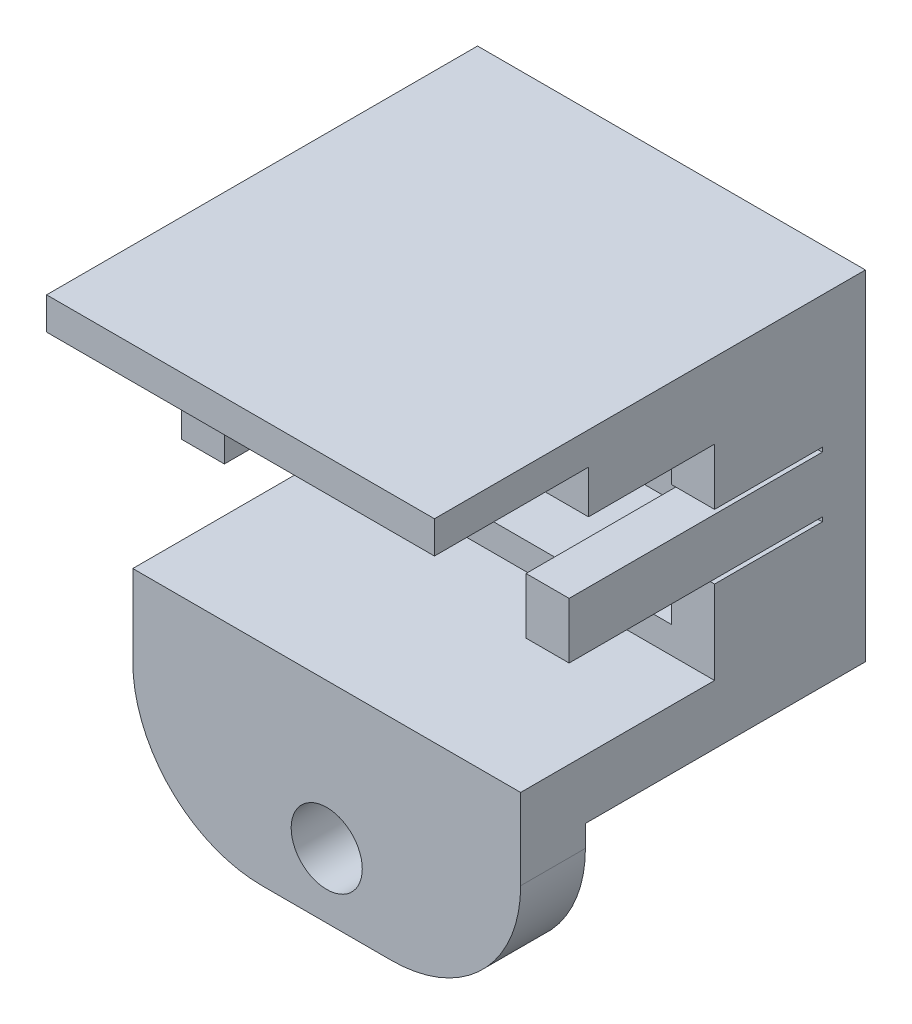
from build123d import *
from build123d.topology import SkipClean

# Parameters (mm, degrees)
ESBO_O1_R                 = 1.65
RESSALTO_EXTRUS_O1_DEPTH  = 3
RESSALTO_EXTRUS_O2_START  = 15
ESBO_O2_R                 = 1.65
RESSALTO_EXTRUS_O2_DEPTH  = 15
CORTE_EXTRUS_O1_DEPTH     = 15
RESSALTO_EXTRUS_O3_DEPTH  = 2
ESBO_O6_W                 = 23.468316857
ESBO_O6_H                 = 21.298976644
CORTE_EXTRUS_O2_DEPTH     = 21
ESBO_O7_W                 = 18
ESBO_O7_H                 = 18
RESSALTO_EXTRUS_O4_DEPTH  = 2
CORTE_EXTRUS_O3_DEPTH     = 5
ESBO_O9_W                 = 18
ESBO_O9_H                 = 2
CORTE_EXTRUS_O4_DEPTH     = 8
ESBO_O10_W                = 18
ESBO_O10_H                = 12.25
RESSALTO_EXTRUS_O5_DEPTH  = 2
RESSALTO_EXTRUS_O6_DEPTH  = 5.85
ESBO_O12_W                = 2
ESBO_O12_H                = 2.6
RESSALTO_EXTRUS_O7_DEPTH  = 9.75
ESBO_O13_W                = 18
ESBO_O13_H                = 7.85
RESSALTO_EXTRUS_O8_DEPTH  = 1.5
ESBO_O14_W                = 18
ESBO_O14_H                = 1.5
RESSALTO_EXTRUS_O9_DEPTH  = 5.15
ESBO_O15_R                = 3.125
CORTE_EXTRUS_O5_DEPTH     = 5.15
ESBO_O16_W                = 2
ESBO_O16_H                = 2.625
RESSALTO_EXTRUS_O10_DEPTH = 5
ESBO_O18_W                = 2
ESBO_O18_H                = 2.6
RESSALTO_EXTRUS_O11_DEPTH = 5
ESBO_O19_W                = 18
ESBO_O19_H                = 2
RESSALTO_EXTRUS_O12_DEPTH = 5
ESBO_O20_W                = 18
ESBO_O20_H                = 1.5
RESSALTO_EXTRUS_O13_DEPTH = 5
ESBO_O21_W                = 18
ESBO_O21_H                = 7
RESSALTO_EXTRUS_O14_DEPTH = 3
ESBO_O22_W                = 18
ESBO_O22_H                = 2.75
RESSALTO_EXTRUS_O15_DEPTH = 9
ESBO_O23_W                = 18
ESBO_O23_H                = 3.006158343
RESSALTO_EXTRUS_O16_DEPTH = 6
ESBO_O24_W                = 27.560641217
ESBO_O24_H                = 36.557163592
CORTE_EXTRUS_O6_DEPTH     = 26
ESBO_O25_W                = 18
ESBO_O25_H                = 1.5
RESSALTO_EXTRUS_O17_DEPTH = 2
ESBO_O26_R                = 1.65
CORTE_EXTRUS_O7_DEPTH     = 10
FILETE1_R                 = 6
ESBO_O27_W                = 18
ESBO_O27_H                = 12.993841657
CORTE_EXTRUS_O8_DEPTH     = 1
ESBO_O28_W                = 18
ESBO_O28_H                = 9
RESSALTO_EXTRUS_O18_DEPTH = 1
ESBO_O29_W                = 2
ESBO_O29_H                = 2.6
CORTE_EXTRUS_O9_DEPTH     = 3


with BuildPart() as part:
    # Esboço1 → Ressalto-extrusão1 (new body)
    # profile 1 of 3: a face of its own
    with BuildSketch(Plane.XY):
        Polygon((-7, 15.25), (-9, 15.25), (-9, 13.25), (-9, 5), (-6.541451884, 0), (-2.020725942, -6), (2.020725942, -6), (6.541451884, 0), (9, 5), (9, 15.25), (7, 15.25), align=None)
        Polygon((2.020725942, -3.5), (4.041451884, 0), (2.020725942, 3.5), (-2.020725942, 3.5), (-4.041451884, 0), (-2.020725942, -3.5), align=None, mode=Mode.SUBTRACT)
        Polygon((-7, 13.25), (-7, 5), (0, 5), (7, 5), (7, 13.25), align=None, mode=Mode.SUBTRACT)
    # profile 2 of 3: a face of its own
    with BuildSketch(Plane.XY):
        Polygon((7, 13.25), (-7, 13.25), (-7, 5), (0, 5), (7, 5), align=None)
    # profile 3 of 3: a face of its own
    with BuildSketch(Plane.XY):
        Polygon((-2.020725942, -3.5), (2.020725942, -3.5), (4.041451884, 0), (2.020725942, 3.5), (-2.020725942, 3.5), (-4.041451884, 0), align=None)
        Circle(ESBO_O1_R, mode=Mode.SUBTRACT)
    extrude(amount=RESSALTO_EXTRUS_O1_DEPTH)

    # Esboço2 → Ressalto-extrusão2 (add)
    # profile 1 of 2: a face of its own
    with SkipClean():  # the faces are left unmerged after this step: merging them gives an invalid solid
        with BuildSketch(Plane(origin=(0, 0, 0), x_dir=(-1, 0, 0), z_dir=(0, 0, -1)).offset(RESSALTO_EXTRUS_O2_START)):
            Polygon((9, 5), (9, 15.25), (-9, 15.25), (-9, 5), (-6.541451884, 0), (-2.020725942, -6), (2.020725942, -6), (6.541451884, 0), align=None)
            Polygon((7, 5), (7, 13.25), (-7, 13.25), (-7, 5), (0, 5), align=None, mode=Mode.SUBTRACT)
            Polygon((-4.041451884, 0), (-2.020725942, -3.5), (2.020725942, -3.5), (4.041451884, 0), (2.020725942, 3.5), (-2.020725942, 3.5), align=None, mode=Mode.SUBTRACT)
        # profile 2 of 2: a face of its own
        with BuildSketch(Plane(origin=(0, 0, 0), x_dir=(-1, 0, 0), z_dir=(0, 0, -1)).offset(RESSALTO_EXTRUS_O2_START)):
            Polygon((-2.020725942, 3.5), (-4.041451884, 0), (-2.020725942, -3.5), (2.020725942, -3.5), (4.041451884, 0), (2.020725942, 3.5), align=None)
            Circle(ESBO_O2_R, mode=Mode.SUBTRACT)
        extrude(amount=-RESSALTO_EXTRUS_O2_DEPTH)

    # Esboço3 → Corte-extrusão1 (cut)
    with SkipClean():  # the faces are left unmerged after this step: merging them gives an invalid solid
        with BuildSketch(Plane(origin=(0, 0, -15), x_dir=(-1, 0, 0), z_dir=(0, 0, -1))):
            Polygon((-9, 10.625), (-9, 9.125), (-9, 7.625), (-7, 7.625), (-7, 10.625), align=None)
            Polygon((9, 7.625), (9, 9.125), (9, 10.625), (7, 10.625), (7, 7.625), align=None)
        extrude(amount=-CORTE_EXTRUS_O1_DEPTH, mode=Mode.SUBTRACT)

    # Esboço5 → Ressalto-extrusão3 (add)
    with SkipClean():  # the faces are left unmerged after this step: merging them gives an invalid solid
        with BuildSketch(Plane(origin=(0, 0, 0), x_dir=(-1, 0, 0), z_dir=(0, 0, -1))):
            Polygon((-1.583333333, 13.25), (-2.333333333, 13.25), (-3.083333333, 13.25), (-3.083333333, 5), (-1.583333333, 5), align=None)
        extrude(amount=RESSALTO_EXTRUS_O3_DEPTH)

    # Esboço6 → Corte-extrusão2 (cut)
    with BuildSketch(Plane(origin=(0, -16, 0), x_dir=(-1, 0, 0), z_dir=(0, -1, 0))):
        with Locations((-0.042259875, 5.70418088)):
            Rectangle(ESBO_O6_W, ESBO_O6_H)
    extrude(amount=-CORTE_EXTRUS_O2_DEPTH, mode=Mode.SUBTRACT)

    # Esboço7 → Ressalto-extrusão4 (add)
    with BuildSketch(Plane.XZ.offset(-5)):
        with Locations((0, -6)):
            Rectangle(ESBO_O7_W, ESBO_O7_H)
    extrude(amount=RESSALTO_EXTRUS_O4_DEPTH)

    # Esboço8 → Corte-extrusão3 (cut)
    with BuildSketch(Plane(origin=(0, 0, -15), x_dir=(-1, 0, 0), z_dir=(0, 0, -1))):
        Polygon((7, 7.625), (7, 5), (-7, 5), (-7, 7.625), (-9, 7.625), (-9, 3), (9, 3), (9, 7.625), align=None)
        Polygon((7, 10.625), (9, 10.625), (9, 15.25), (-9, 15.25), (-9, 10.625), (-7, 10.625), (-7, 13.25), (7, 13.25), align=None)
    extrude(amount=-CORTE_EXTRUS_O3_DEPTH, mode=Mode.SUBTRACT)

    # Esboço9 → Corte-extrusão4 (cut)
    with BuildSketch(Plane(origin=(0, 0, -10), x_dir=(-1, 0, 0), z_dir=(0, 0, -1))):
        with Locations((0, 14.25)):
            Rectangle(ESBO_O9_W, ESBO_O9_H)
    extrude(amount=-CORTE_EXTRUS_O4_DEPTH, mode=Mode.SUBTRACT)

    # Esboço24 → Corte-extrusão6 (cut)
    with BuildSketch(Plane.XY.offset(13)):
        with Locations((-1.631661855, 4.199263035)):
            Rectangle(ESBO_O24_W, ESBO_O24_H)
    extrude(amount=-CORTE_EXTRUS_O6_DEPTH, mode=Mode.SUBTRACT)


with BuildPart() as body_2:
    # Esboço10 → Ressalto-extrusão5 (new body)
    with BuildSketch(Plane(origin=(0, 0, -40), x_dir=(-1, 0, 0), z_dir=(0, 0, -1))):
        with Locations((0, 9.125)):
            Rectangle(ESBO_O10_W, ESBO_O10_H)
    extrude(amount=RESSALTO_EXTRUS_O5_DEPTH)

    # Esboço11 → Ressalto-extrusão6 (add)
    with BuildSketch(Plane.XY.offset(-40)):
        Polygon((9, 15.25), (-9, 15.25), (-9, 13.25), (-7, 13.25), (1.583333333, 13.25), (3.083333333, 13.25), (7, 13.25), (9, 13.25), align=None)
    extrude(amount=RESSALTO_EXTRUS_O6_DEPTH)

    # Esboço12 → Ressalto-extrusão7 (add)
    with BuildSketch(Plane.XY.offset(-40)):
        with Locations((8, 9.125)):
            Rectangle(ESBO_O12_W, ESBO_O12_H)
        with Locations((-8, 9.125)):
            Rectangle(ESBO_O12_W, ESBO_O12_H)
    extrude(amount=RESSALTO_EXTRUS_O7_DEPTH)

    # Esboço13 → Ressalto-extrusão8 (add)
    with BuildSketch(Plane(origin=(0, 15.25, 0), x_dir=(1, 0, 0), z_dir=(0, 1, 0))):
        with Locations((0, 38.075)):
            Rectangle(ESBO_O13_W, ESBO_O13_H)
    extrude(amount=RESSALTO_EXTRUS_O8_DEPTH)

    # Esboço14 → Ressalto-extrusão9 (add)
    with BuildSketch(Plane.XY.offset(-34.15)):
        with Locations((0, 16)):
            Rectangle(ESBO_O14_W, ESBO_O14_H)
    extrude(amount=RESSALTO_EXTRUS_O9_DEPTH)

    # Esboço15 → Corte-extrusão5 (cut)
    with BuildSketch(Plane(origin=(0, 0, -42), x_dir=(-1, 0, 0), z_dir=(0, 0, -1))):
        with Locations((0, 9.875)):
            Circle(ESBO_O15_R)
    extrude(amount=-CORTE_EXTRUS_O5_DEPTH, mode=Mode.SUBTRACT)

    # Esboço16 → Ressalto-extrusão10 (add)
    with BuildSketch(Plane.XY.offset(-40)):
        Polygon((-7, 7.625), (-9, 7.625), (-9, 3), (9, 3), (9, 7.625), (7, 7.625), (7, 5), (-7, 5), align=None)
        with Locations((-8, 11.9375)):
            Rectangle(ESBO_O16_W, ESBO_O16_H)
        with Locations((8, 11.9375)):
            Rectangle(ESBO_O16_W, ESBO_O16_H)
    extrude(amount=RESSALTO_EXTRUS_O10_DEPTH)

    # Esboço18 → Ressalto-extrusão11 (add)
    with BuildSketch(Plane.XY.offset(-30.25)):
        with Locations((-8, 9.125)):
            Rectangle(ESBO_O18_W, ESBO_O18_H)
        with Locations((8, 9.125)):
            Rectangle(ESBO_O18_W, ESBO_O18_H)
    extrude(amount=RESSALTO_EXTRUS_O11_DEPTH)

    # Esboço19 → Ressalto-extrusão12 (add)
    with BuildSketch(Plane.XY.offset(-34.15)):
        with Locations((0, 14.25)):
            Rectangle(ESBO_O19_W, ESBO_O19_H)
    extrude(amount=RESSALTO_EXTRUS_O12_DEPTH)

    # Esboço20 → Ressalto-extrusão13 (add)
    with BuildSketch(Plane.XY.offset(-29)):
        with Locations((0, 16)):
            Rectangle(ESBO_O20_W, ESBO_O20_H)
    extrude(amount=RESSALTO_EXTRUS_O13_DEPTH)

    # Esboço21 → Ressalto-extrusão14 (add)
    with BuildSketch(Plane.XZ.offset(-3)):
        with Locations((0, -38.5)):
            Rectangle(ESBO_O21_W, ESBO_O21_H)
    extrude(amount=RESSALTO_EXTRUS_O14_DEPTH)

    # Esboço22 → Ressalto-extrusão15 (add)
    with BuildSketch(Plane.XY.offset(-35)):
        with Locations((0, 1.375)):
            Rectangle(ESBO_O22_W, ESBO_O22_H)
    extrude(amount=RESSALTO_EXTRUS_O15_DEPTH)

    # Esboço23 → Ressalto-extrusão16 (add)
    with BuildSketch(Plane.XZ):
        with Locations((0, -27.503079172)):
            Rectangle(ESBO_O23_W, ESBO_O23_H)
    extrude(amount=RESSALTO_EXTRUS_O16_DEPTH)

    # Esboço25 → Ressalto-extrusão17 (add)
    with BuildSketch(Plane.XY.offset(-24)):
        with Locations((0, 16)):
            Rectangle(ESBO_O25_W, ESBO_O25_H)
    extrude(amount=RESSALTO_EXTRUS_O17_DEPTH)

    # Esboço26 → Corte-extrusão7 (cut)
    with BuildSketch(Plane(origin=(0, 0, -29.006158343), x_dir=(-1, 0, 0), z_dir=(0, 0, -1))):
        with Locations((0, -3)):
            Circle(ESBO_O26_R)
    extrude(amount=-CORTE_EXTRUS_O7_DEPTH, mode=Mode.SUBTRACT)

    # Filete1
    filete1_edges = [body_2.edges().sort_by_distance(p)[0] for p in [
        (-9, -6, -27.503079172),
        (9, -6, -27.503079172),
    ]]
    fillet(filete1_edges, radius=FILETE1_R)

    # Esboço27 → Corte-extrusão8 (cut)
    with BuildSketch(Plane.XZ):
        with Locations((0, -35.503079172)):
            Rectangle(ESBO_O27_W, ESBO_O27_H)
    extrude(amount=-CORTE_EXTRUS_O8_DEPTH, mode=Mode.SUBTRACT)

    # Esboço28 → Ressalto-extrusão18 (add)
    with BuildSketch(Plane(origin=(0, 2.75, 0), x_dir=(1, 0, 0), z_dir=(0, 1, 0))):
        with Locations((0, 30.5)):
            Rectangle(ESBO_O28_W, ESBO_O28_H)
    extrude(amount=RESSALTO_EXTRUS_O18_DEPTH)

    # Esboço29 → Corte-extrusão9 (cut)
    with BuildSketch(Plane.XY.offset(-25.25)):
        with Locations((8, 9.125)):
            Rectangle(ESBO_O29_W, ESBO_O29_H)
        with Locations((-8, 9.125)):
            Rectangle(ESBO_O29_W, ESBO_O29_H)
    extrude(amount=-CORTE_EXTRUS_O9_DEPTH, mode=Mode.SUBTRACT)


solid = body_2.part
